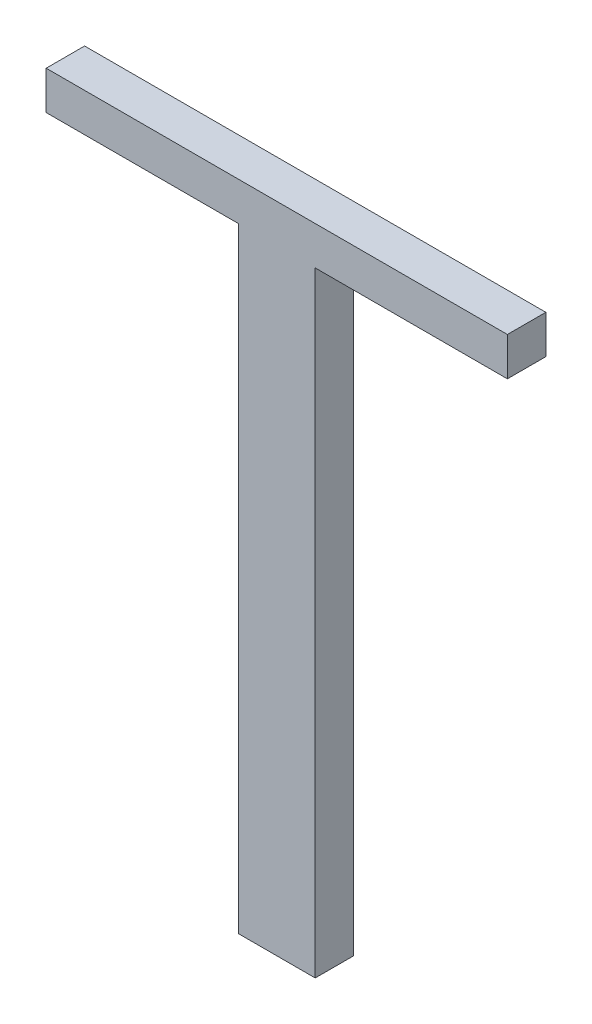
from build123d import *

# Parameters (mm, degrees)
BOSS_EXTRUDE1_DEPTH = 5


with BuildPart() as part:
    # Sketch1 → Boss-Extrude1 (new body)
    with BuildSketch(Plane.XY):
        Polygon((10, 80), (35, 80), (35, 85), (-25, 85), (-25, 80), (0, 80), (0, 0), (10, 0), align=None)
    extrude(amount=BOSS_EXTRUDE1_DEPTH)


solid = part.part
